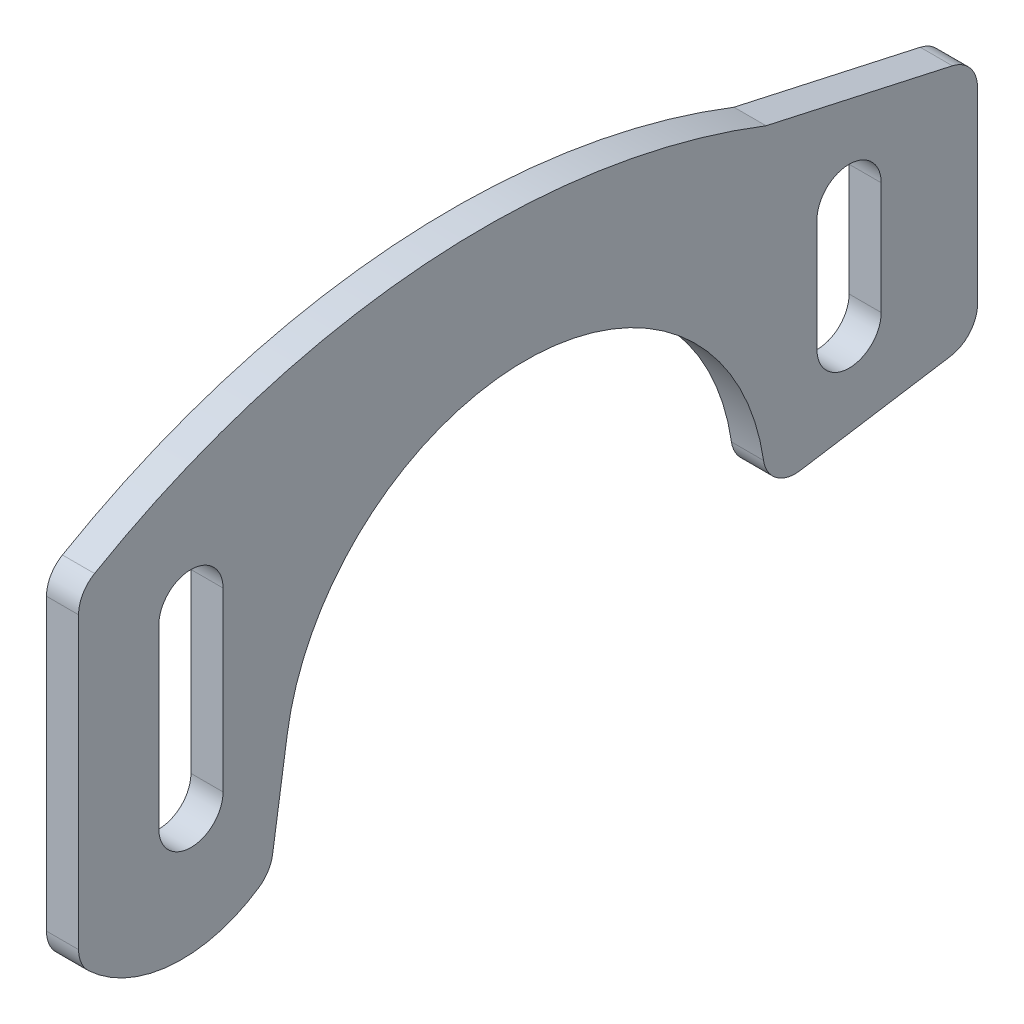
from build123d import *

# Parameters (mm, degrees)
RESSALTO_EXTRUS_O1_DEPTH = 2


with BuildPart() as part:
    # Esboço1 → Ressalto-extrusão1 (new body)
    with BuildSketch(Plane(origin=(0, 0, 0), x_dir=(0, 0, -1), z_dir=(1, 0, 0))):
        with BuildLine():
            Line((0, -1.135256663), (0, -19.198580097))
            ThreePointArc((0, -19.198580097), (0.165672539, -19.99560128), (0.635242767, -20.66057794))
            ThreePointArc((0.635242767, -20.66057794), (5.79673997, -22.923055217), (11.239007951, -21.459642756))
            ThreePointArc((11.239007951, -21.459642756), (11.802930255, -20.872546688), (12.086175338, -20.109354458))
            Line((12.086175338, -20.109354458), (13, -14.080459117))
            ThreePointArc((13, -14.080459117), (27.8629628, -1.328429998), (42.670766881, -14.144468704))
            ThreePointArc((42.670766881, -14.144468704), (43.465031593, -15.464843047), (44.962324336, -15.8286552))
            Line((44.962324336, -15.8286552), (54.31286893, -14.347674427))
            ThreePointArc((54.31286893, -14.347674427), (55.520811931, -13.671193843), (56, -12.372297746))
            Line((56, -12.372297746), (56, -0.68631259))
            ThreePointArc((56, -0.68631259), (55.559508665, 0.565858613), (54.432067277, 1.266459252))
            Line((54.432067277, 1.266459252), (42.829728449, 3.833574795))
            ThreePointArc((42.829728449, 3.833574795), (21.542961045, 6.988627316), (0.995627431, 0.594262271))
            ThreePointArc((0.995627431, 0.594262271), (0.2666874, -0.137445342), (0, -1.135256663))
        make_face()
        with BuildLine():
            Line((9, -4.191253682), (9, -15.191253682))
            ThreePointArc((9, -15.191253682), (7, -17.191253682), (5, -15.191253682))
            Line((5, -15.191253682), (5, -4.191253682))
            ThreePointArc((5, -4.191253682), (7, -2.191253682), (9, -4.191253682))
        make_face(mode=Mode.SUBTRACT)
        with BuildLine():
            Line((50, -2.828963065), (50, -9.828963065))
            ThreePointArc((50, -9.828963065), (48, -11.828963065), (46, -9.828963065))
            Line((46, -9.828963065), (46, -2.828963065))
            ThreePointArc((46, -2.828963065), (48, -0.828963065), (50, -2.828963065))
        make_face(mode=Mode.SUBTRACT)
    extrude(amount=RESSALTO_EXTRUS_O1_DEPTH)


solid = part.part
